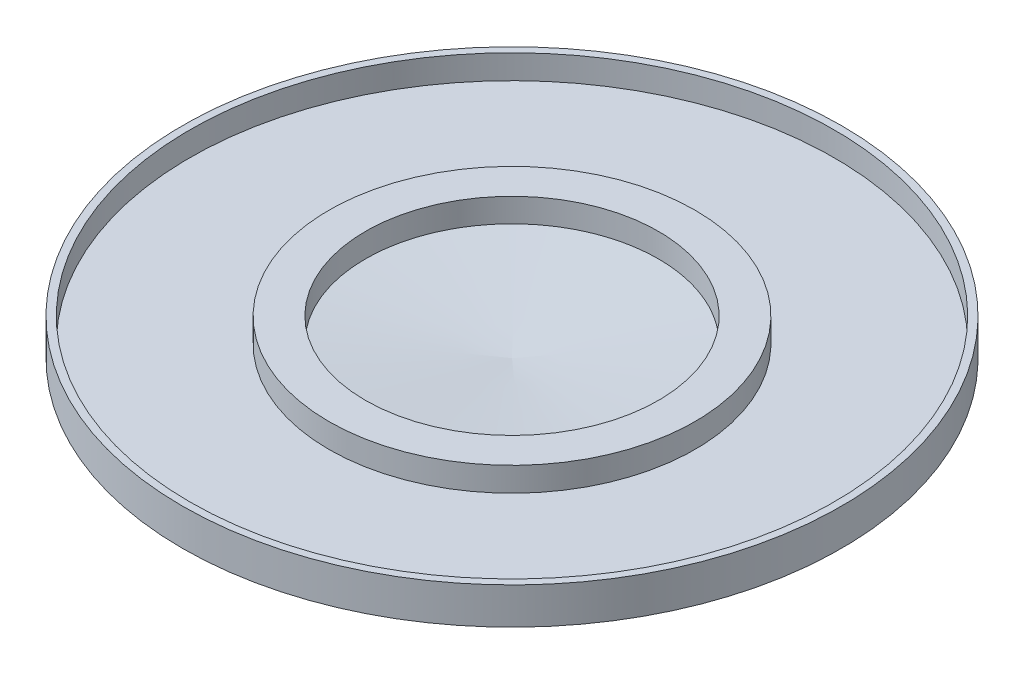
from build123d import *

# Parameters (mm, degrees)
SKETCH_8_R        = 250
SKETCH_8_R_2      = 200.02
EXTRUDE_1_DEPTH   = 50
SKETCH_8_R_3      = 450
SKETCH_8_R_4      = 440
EXTRUDE_1_2_DEPTH = 50
SKETCH_8_3_R      = 440
SKETCH_8_3_R_2    = 250
EXTRUDE_2_DEPTH   = 17


with BuildPart() as part:
    # 草图1 → 旋转1 (revolve)
    with BuildSketch(Plane.XY):
        Polygon((0, 0), (200, 17.49923176), (200, 0), align=None)
    revolve(axis=Axis((-0.01, 0, 0), (0, 1, 0)))


with BuildPart() as body_2:
    # 草图8 → 凸台-拉伸1 (new body)
    with BuildSketch(Plane(origin=(0, 0, 0), x_dir=(1, 0, 0), z_dir=(0, 1, 0))):
        Circle(SKETCH_8_R)
        Circle(SKETCH_8_R_2, mode=Mode.SUBTRACT)
    extrude(amount=EXTRUDE_1_DEPTH)



with BuildPart() as body_3:
    # 草图8 → Extrude 1 2 (new body)
    with BuildSketch(Plane(origin=(0, 0, 0), x_dir=(1, 0, 0), z_dir=(0, 1, 0))):
        Circle(SKETCH_8_R_3)
        Circle(SKETCH_8_R_4, mode=Mode.SUBTRACT)
    extrude(amount=EXTRUDE_1_2_DEPTH)


with BuildPart() as body_2_1:
    add(body_2.part)

    add(body_3.part)  # 凸台-拉伸2 merges body 3
    # 草图8<3> → 凸台-拉伸2 (add)
    with BuildSketch(Plane(origin=(0, 0, 0), x_dir=(1, 0, 0), z_dir=(0, 1, 0))):
        Circle(SKETCH_8_3_R)
        Circle(SKETCH_8_3_R_2, mode=Mode.SUBTRACT)
    extrude(amount=EXTRUDE_2_DEPTH)


solid = Compound([part.part, body_2_1.part])
